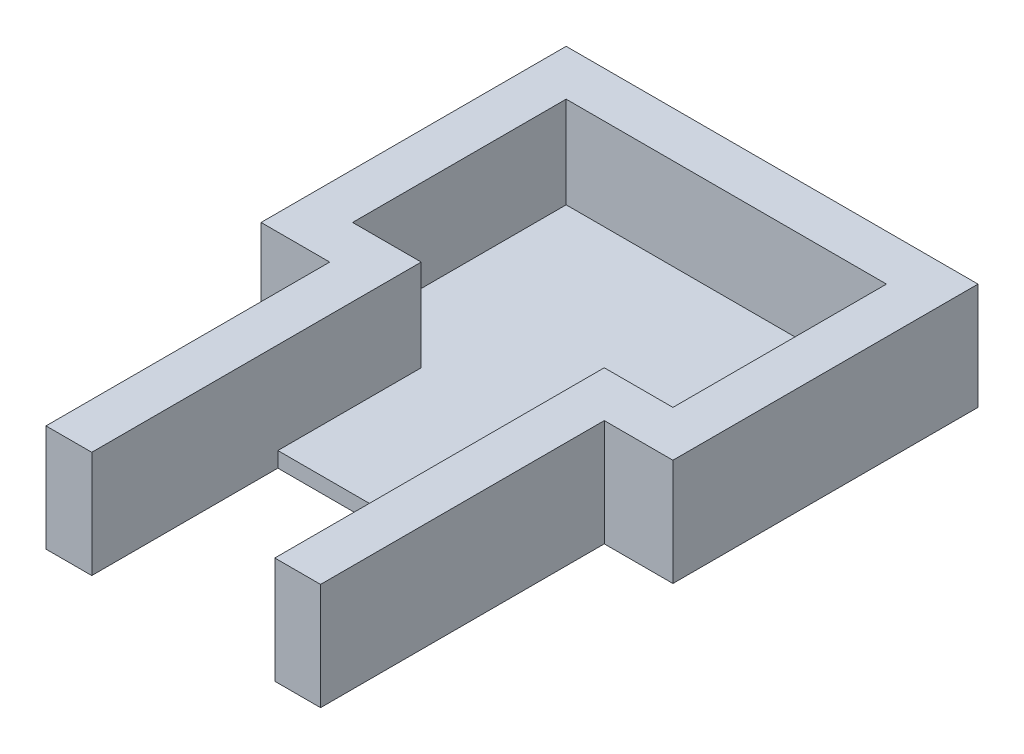
from build123d import *

# Parameters (mm, degrees)
BOSS_EXTRUDE1_DEPTH = 5
BOSS_EXTRUDE2_DEPTH = 30
SKETCH3_W           = 60
SKETCH3_H           = 61
CUT_EXTRUDE1_DEPTH  = 162.957556168


with BuildPart() as part:
    # Sketch1 → Boss-Extrude1 (new body)
    with BuildSketch(Plane(origin=(0, 0, 0), x_dir=(1, 0, 0), z_dir=(0, 1, 0))):
        Polygon((67.5, -50), (45, -50), (45, -143), (-45, -143), (-45, -50), (-67.5, -50), (-67.5, 50), (67.5, 50), align=None)
    extrude(amount=BOSS_EXTRUDE1_DEPTH)

    # Sketch2 → Boss-Extrude2 (add)
    with BuildSketch(Plane(origin=(0, 5, 0), x_dir=(1, 0, 0), z_dir=(0, 1, 0))):
        Polygon((-67.5, 50), (-67.5, -50), (-45, -50), (-45, -143), (45, -143), (45, -50), (67.5, -50), (67.5, 50), align=None)
        Polygon((52.5, 35), (-52.5, 35), (-52.5, -35), (-30, -35), (-30, -128), (30, -128), (30, -35), (52.5, -35), align=None, mode=Mode.SUBTRACT)
    extrude(amount=BOSS_EXTRUDE2_DEPTH)

    # Sketch3 → Cut-Extrude1 (cut, through all)
    with BuildSketch(Plane(origin=(0, 35, 0), x_dir=(1, 0, 0), z_dir=(0, 1, 0))):
        with Locations((0, -112.5)):
            Rectangle(SKETCH3_W, SKETCH3_H)
    extrude(amount=-CUT_EXTRUDE1_DEPTH, mode=Mode.SUBTRACT)


solid = part.part
